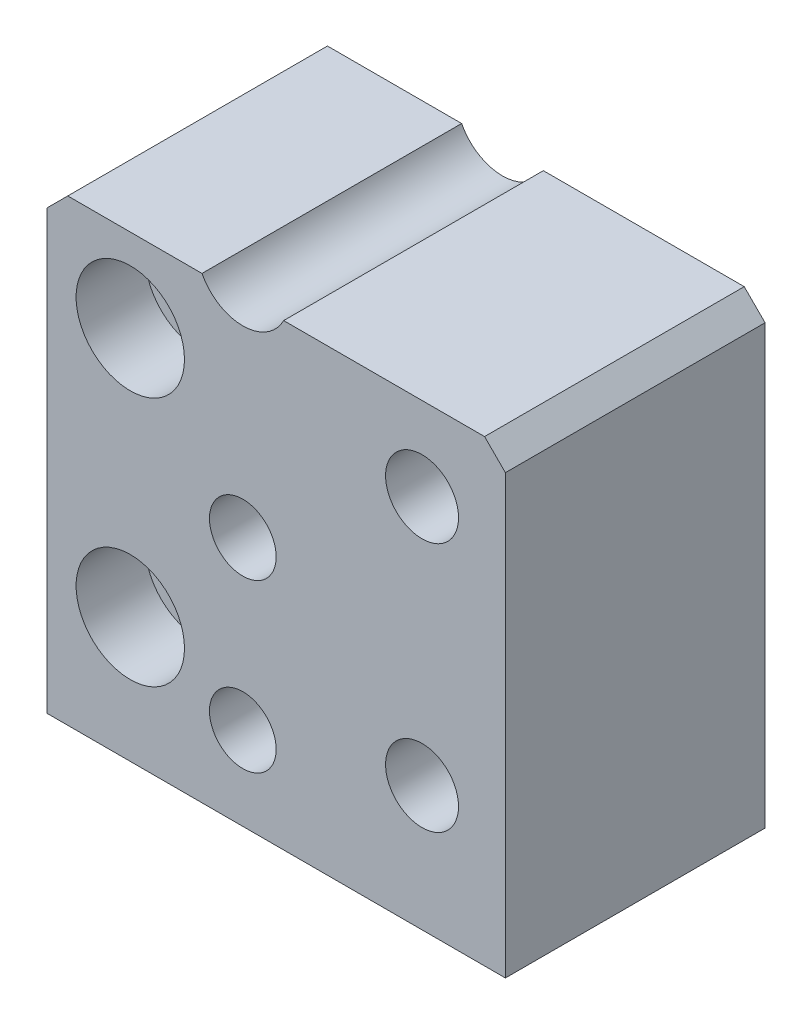
from build123d import *

# Parameters (mm, degrees)
SKIZZE1_W                                            = 110
SKIZZE1_H                                            = 62.3
AUFSATZ_LINEAR_AUSTRAGEN1_DEPTH                      = 110
DURCHGANGSLOCH_F_R_M161_D                            = 17.5
STIRNSENKUNG_F_R_M16_ZYLINDERSCHRAUBE_MI_D           = 17.5
STIRNSENKUNG_F_R_M16_ZYLINDERSCHRAUBE_MI_CBORE_D     = 26
STIRNSENKUNG_F_R_M16_ZYLINDERSCHRAUBE_MI_CBORE_DEPTH = 16.6
F_16_0_H7_16_DURCHMESSER_BOHRUNG2_D                  = 16
F_22_0_22_DURCHMESSER_BOHRUNG1_D                     = 22
FASE1_SIZE                                           = 5
STIRNSENKUNG_F_R_M16_ZYLINDERSCHRAUB_2_D             = 17.5
STIRNSENKUNG_F_R_M16_ZYLINDERSCHRAUB_2_CBORE_D       = 26
STIRNSENKUNG_F_R_M16_ZYLINDERSCHRAUB_2_CBORE_DEPTH   = 16.6


with BuildPart() as part:
    # Skizze1 → Aufsatz-Linear austragen1 (new body)
    with BuildSketch(Plane(origin=(0, 0, 0), x_dir=(1, 0, 0), z_dir=(0, 1, 0))):
        Rectangle(SKIZZE1_W, SKIZZE1_H)
    extrude(amount=AUFSATZ_LINEAR_AUSTRAGEN1_DEPTH)

    # Durchgangsloch für M161 (through all)
    with Locations(Plane.XY.offset(31.15)):
        with Locations((35, 90), (35, 30)):
            Hole(DURCHGANGSLOCH_F_R_M161_D / 2)

    # Stirnsenkung f_r M16 Zylinderschraube mi (through all)
    with Locations(Plane.XY.offset(31.15)):
        with Locations((-35, 90), (-35, 30)):
            CounterBoreHole(STIRNSENKUNG_F_R_M16_ZYLINDERSCHRAUBE_MI_D / 2, STIRNSENKUNG_F_R_M16_ZYLINDERSCHRAUBE_MI_CBORE_D / 2, STIRNSENKUNG_F_R_M16_ZYLINDERSCHRAUBE_MI_CBORE_DEPTH)

    # Ø16.0 H7 (16) Durchmesser Bohrung2 (through all)
    with Locations(Plane(origin=(0, 0, -31.15), x_dir=(-1, 0, 0), z_dir=(0, 0, -1))):
        with Locations((8, 60), (8, 20)):
            Hole(F_16_0_H7_16_DURCHMESSER_BOHRUNG2_D / 2)

    # Ø22.0 (22) Durchmesser Bohrung1 (through all)
    with Locations(Plane(origin=(0, 0, -31.15), x_dir=(-1, 0, 0), z_dir=(0, 0, -1))):
        with Locations((8, 115)):
            Hole(F_22_0_22_DURCHMESSER_BOHRUNG1_D / 2)

    # Fase1
    fase1_edges = [part.edges().sort_by_distance(p)[0] for p in [
        (-55, 110, 0),
        (55, 110, 0),
    ]]
    chamfer(fase1_edges, length=FASE1_SIZE)

    # Stirnsenkung f_r M16 Zylinderschraub 2 (through all)
    with Locations(Plane(origin=(0, 0, -31.15), x_dir=(-1, 0, 0), z_dir=(0, 0, -1))):
        with Locations((35, 90), (35, 30)):
            CounterBoreHole(STIRNSENKUNG_F_R_M16_ZYLINDERSCHRAUB_2_D / 2, STIRNSENKUNG_F_R_M16_ZYLINDERSCHRAUB_2_CBORE_D / 2, STIRNSENKUNG_F_R_M16_ZYLINDERSCHRAUB_2_CBORE_DEPTH)


solid = part.part
